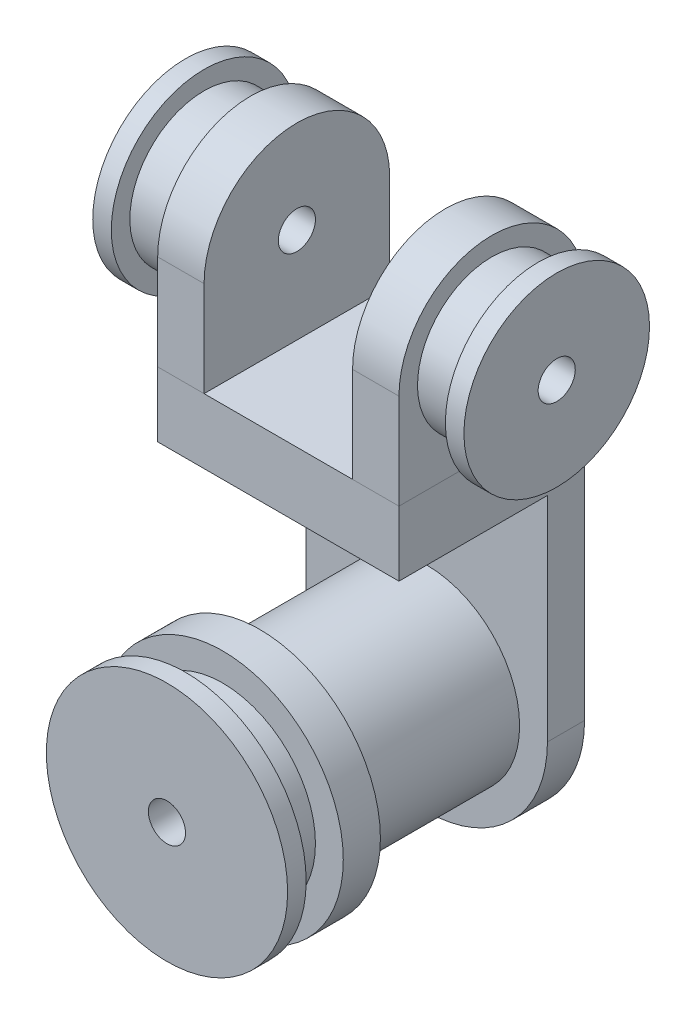
from build123d import *

# Parameters (mm, degrees)
SKETCH4_R            = 5
SKETCH4_R_2          = 1
BOSS_EXTRUDE5_DEPTH  = 15
BOSS_EXTRUDE7_START  = -4
SKETCH5_R            = 6.5
SKETCH5_R_2          = 1
BOSS_EXTRUDE7_DEPTH  = 2
SKETCH7_R            = 6.5
SKETCH7_R_2          = 1
BOSS_EXTRUDE8_DEPTH  = 1
SKETCH8_R            = 1
BOSS_EXTRUDE9_DEPTH  = 2
BOSS_EXTRUDE10_DEPTH = 10
SKETCH10_R           = 1
BOSS_EXTRUDE11_DEPTH = 2.5
SKETCH11_R           = 4
SKETCH11_R_2         = 1
BOSS_EXTRUDE12_DEPTH = 2.5
SKETCH12_R           = 5
SKETCH12_R_2         = 1
BOSS_EXTRUDE13_DEPTH = 1


with BuildPart() as part:
    # Sketch4 → Boss-Extrude5 (new body)
    with BuildSketch(Plane.XY):
        Circle(SKETCH4_R)
        Circle(SKETCH4_R_2, mode=Mode.SUBTRACT)
    extrude(amount=BOSS_EXTRUDE5_DEPTH)

    # Sketch5 → Boss-Extrude7 (add)
    with BuildSketch(Plane.XY.offset(15).offset(BOSS_EXTRUDE7_START)):
        Circle(SKETCH5_R)
        Circle(SKETCH5_R_2, mode=Mode.SUBTRACT)
    extrude(amount=BOSS_EXTRUDE7_DEPTH)

    # Sketch7 → Boss-Extrude8 (add)
    with BuildSketch(Plane.XY.offset(15)):
        Circle(SKETCH7_R)
        Circle(SKETCH7_R_2, mode=Mode.SUBTRACT)
    extrude(amount=BOSS_EXTRUDE8_DEPTH)

    # Sketch8 → Boss-Extrude9 (add)
    with BuildSketch(Plane(origin=(0, 0, 0), x_dir=(-1, 0, 0), z_dir=(0, 0, -1))):
        with BuildLine():
            Line((6.5, 0), (6.5, 13))
            Line((6.5, 13), (-6.5, 13))
            Line((-6.5, 13), (-6.5, 0))
            ThreePointArc((-6.5, 0), (0, -6.5), (6.5, 0))
        make_face()
        with Locations(Location((0, 0, 0), (0, 0, 180))):
            Circle(SKETCH8_R, mode=Mode.SUBTRACT)
    extrude(amount=-BOSS_EXTRUDE9_DEPTH)

    # Sketch9 → Boss-Extrude10 (add)
    with BuildSketch(Plane(origin=(0, 0, 0), x_dir=(-1, 0, 0), z_dir=(0, 0, -1))):
        Polygon((-6.5, 13), (-6.5, 15), (6.5, 15), (6.5, 13), (6.5, 11.5), (-6.5, 11.5), align=None)
    extrude(amount=-BOSS_EXTRUDE10_DEPTH)


with BuildPart() as body_2:
    # Sketch10 → Boss-Extrude11 (new body)
    with BuildSketch(Plane(origin=(6.5, 0, 0), x_dir=(0, 0, -1), z_dir=(1, 0, 0))):
        with BuildLine():
            Line((-10, 20.132551776), (-10, 15))
            Line((-10, 15), (0, 15))
            Line((0, 15), (0, 20.132551776))
            ThreePointArc((0, 20.132551776), (-5, 25.132551776), (-10, 20.132551776))
        make_face()
        with Locations(Location((-5, 20.132551776, 0), (0, 0, 90))):
            Circle(SKETCH10_R, mode=Mode.SUBTRACT)
    extrude(amount=-BOSS_EXTRUDE11_DEPTH)

    # Sketch11 → Boss-Extrude12 (add)
    with BuildSketch(Plane(origin=(6.5, 0, 0), x_dir=(0, 0, -1), z_dir=(1, 0, 0))):
        with Locations(Location((-5, 20.132551776, 0), (0, 0, 90))):
            Circle(SKETCH11_R)
        with Locations(Location((-5, 20.132551776, 0), (0, 0, 90))):
            Circle(SKETCH11_R_2, mode=Mode.SUBTRACT)
    extrude(amount=BOSS_EXTRUDE12_DEPTH)

    # Sketch12 → Boss-Extrude13 (add)
    with BuildSketch(Plane(origin=(9, 0, 0), x_dir=(0, 0, -1), z_dir=(1, 0, 0))):
        with Locations(Location((-5, 20.132551776, 0), (0, 0, 90))):
            Circle(SKETCH12_R)
        with Locations(Location((-5, 20.132551776, 0), (0, 0, 90))):
            Circle(SKETCH12_R_2, mode=Mode.SUBTRACT)
    extrude(amount=BOSS_EXTRUDE13_DEPTH)


with BuildPart() as body_3:
    # Mirror4: mirrored copy
    add(body_2.part.mirror(Plane(origin=(0, 0, 0), x_dir=(0, 0, 1), z_dir=(1, 0, 0))))


solid = Compound([part.part, body_2.part, body_3.part])
